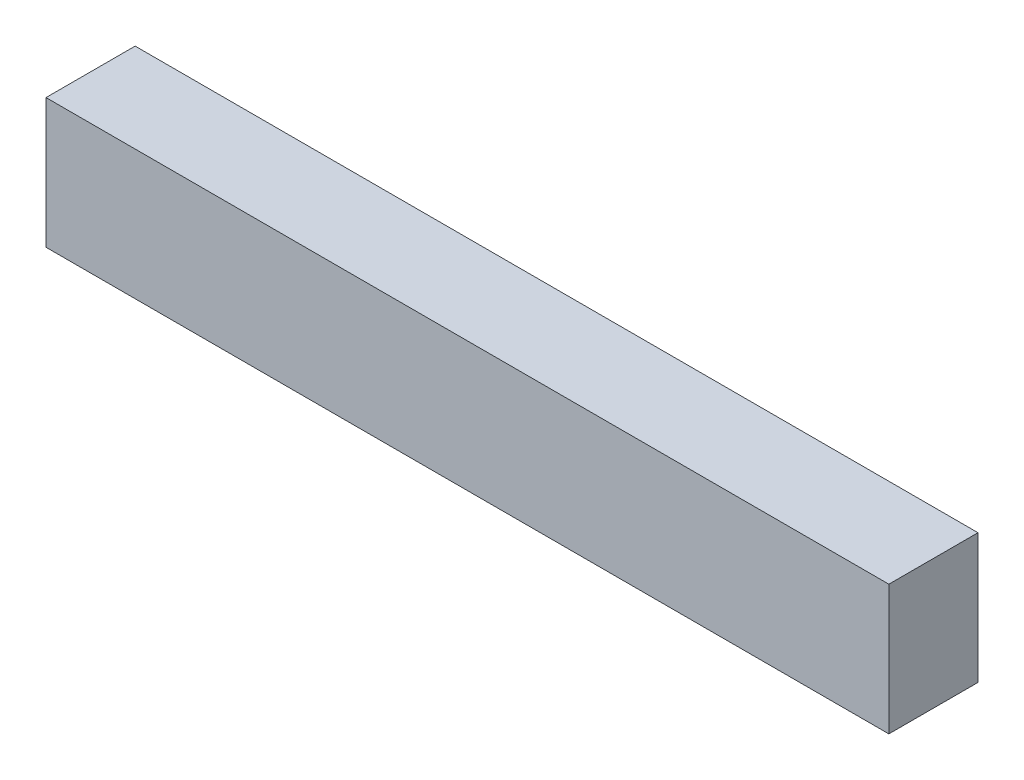
from build123d import *

# Parameters (mm, degrees)
SKETCH_1_W      = 520
SKETCH_1_H      = 80
EXTRUDE_1_DEPTH = 55


with BuildPart() as part:
    # 草图1 → 凸台-拉伸1 (new body)
    with BuildSketch(Plane.XY):
        Rectangle(SKETCH_1_W, SKETCH_1_H)
    extrude(amount=EXTRUDE_1_DEPTH)


solid = part.part
